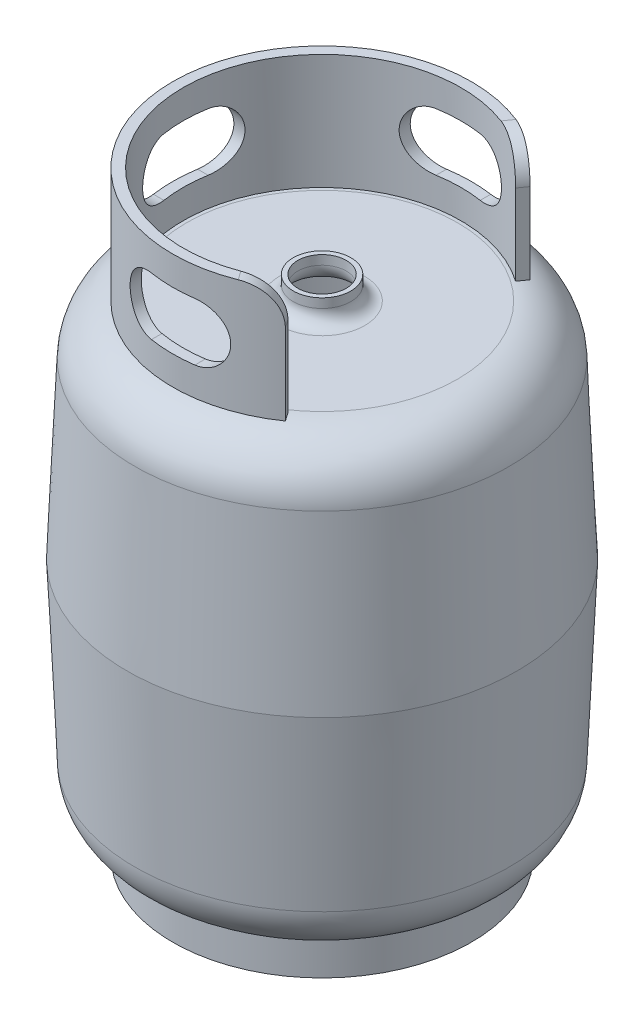
from build123d import *

# Parameters (mm, degrees)
BOSS_EXTRUDE1_DEPTH     = 100
CUT_EXTRUDE1_DEPTH      = 379.564579453
CUT_EXTRUDE1_DEPTH_BACK = 379.564579453
FILLET1_R               = 30
FILLET2_R               = 30
CUT_EXTRUDE2_DEPTH      = 379.56457953
CUT_EXTRUDE2_DEPTH_BACK = 379.56457953
SKETCH6_R               = 129.542830029
SKETCH6_R_2             = 120.542830029
BOSS_EXTRUDE3_DEPTH     = 30


with BuildPart() as part:
    # Sketch1 → Revolve1 (revolve)
    with BuildSketch(Plane.XY, mode=Mode.PRIVATE) as revolve1_sk:
        with BuildLine():
            Line((25, 213.5), (25, 205.5))
            ThreePointArc((25, 205.5), (28.514718626, 197.014718626), (37, 193.5))
            Line((37, 193.5), (117.542830029, 193.5))
            ThreePointArc((117.542830029, 193.5), (148.660917539, 181.006378293), (162.5, 150.462872431))
            Line((162.5, 150.462872431), (169.069350883, 0))
            Line((169.069350883, 0), (162.5, -150.462872431))
            ThreePointArc((162.5, -150.462872431), (148.660917539, -181.006378293), (117.542830029, -193.5))
            Line((117.542830029, -193.5), (0, -193.5))
            Line((0, -193.5), (0, -189.5))
            Line((0, -189.5), (117.542830029, -189.5))
            ThreePointArc((117.542830029, -189.5), (145.894865316, -178.116922444), (158.503807114, -150.288394882))
            Line((158.503807114, -150.288394882), (165.065540142, 0))
            Line((165.065540142, 0), (158.503807114, 150.288394882))
            ThreePointArc((158.503807114, 150.288394882), (145.894865316, 178.116922444), (117.542830029, 189.5))
            Line((117.542830029, 189.5), (37, 189.5))
            ThreePointArc((37, 189.5), (25.686291501, 194.186291501), (21, 205.5))
            Line((21, 205.5), (21, 209.5))
            Line((21, 209.5), (21, 213.5))
            Line((21, 213.5), (25, 213.5))
        make_face()
    revolve(revolve1_sk.sketch.rotate(Axis((0, 0, 0), (0, 1, 0)), 90), axis=Axis((0, 0, 0), (0, 1, 0)))


with BuildPart() as body_2:
    # Sketch2 → Boss-Extrude1 (new body)
    with BuildSketch(Plane(origin=(0, 193.5, 0), x_dir=(1, 0, 0), z_dir=(0, 1, 0))):
        with BuildLine():
            Line((74.302714803, 106.115274041), (69.140526876, 98.742905642))
            ThreePointArc((69.140526876, 98.742905642), (-120.542830029, 0), (69.140526876, -98.742905642))
            Line((69.140526876, -98.742905642), (74.302714803, -106.115274041))
            ThreePointArc((74.302714803, -106.115274041), (-129.542830029, 0), (74.302714803, 106.115274041))
        make_face()
    extrude(amount=BOSS_EXTRUDE1_DEPTH)

    # Sketch3 → Cut-Extrude1 (cut, two sides: drawn at the far end of the back side and taken through both)
    with BuildSketch(Plane.XY.offset(-CUT_EXTRUDE1_DEPTH_BACK)):
        with BuildLine():
            Line((-20, 268.5), (18, 268.5))
            ThreePointArc((18, 268.5), (43, 243.5), (18, 218.5))
            Line((18, 218.5), (-20, 218.5))
            ThreePointArc((-20, 218.5), (-45, 243.5), (-20, 268.5))
        make_face()
    extrude(amount=CUT_EXTRUDE1_DEPTH + CUT_EXTRUDE1_DEPTH_BACK, mode=Mode.SUBTRACT)

    # Fillet1
    fillet1_edges = [body_2.edges().sort_by_distance(p)[0] for p in [
        (71.721620839, 293.5, 102.429089842),
    ]]
    fillet(fillet1_edges, radius=FILLET1_R)

    # Fillet2
    fillet2_edges = [body_2.edges().sort_by_distance(p)[0] for p in [
        (71.721620839, 293.5, -102.429089842),
    ]]
    fillet(fillet2_edges, radius=FILLET2_R)

    # Sketch4 → Cut-Extrude2 (cut, two sides: drawn at the far end of the back side and taken through both)
    with BuildSketch(Plane(origin=(0, 0, 0), x_dir=(0, 0, -1), z_dir=(1, 0, 0)).offset(-CUT_EXTRUDE2_DEPTH_BACK)):
        with BuildLine():
            Line((20, 218.5), (-18, 218.5))
            ThreePointArc((-18, 218.5), (-43, 243.5), (-18, 268.5))
            Line((-18, 268.5), (20, 268.5))
            ThreePointArc((20, 268.5), (45, 243.5), (20, 218.5))
        make_face()
    extrude(amount=CUT_EXTRUDE2_DEPTH + CUT_EXTRUDE2_DEPTH_BACK, mode=Mode.SUBTRACT)


with BuildPart() as body_3:
    # Sketch6 → Boss-Extrude3 (new body)
    with BuildSketch(Plane.XZ.offset(193.5)):
        with Locations(Location((0, 0, 0), (0, 0, 270))):
            Circle(SKETCH6_R)
        with Locations(Location((0, 0, 0), (0, 0, 270))):
            Circle(SKETCH6_R_2, mode=Mode.SUBTRACT)
    extrude(amount=BOSS_EXTRUDE3_DEPTH)


solid = Compound([part.part, body_2.part, body_3.part])
